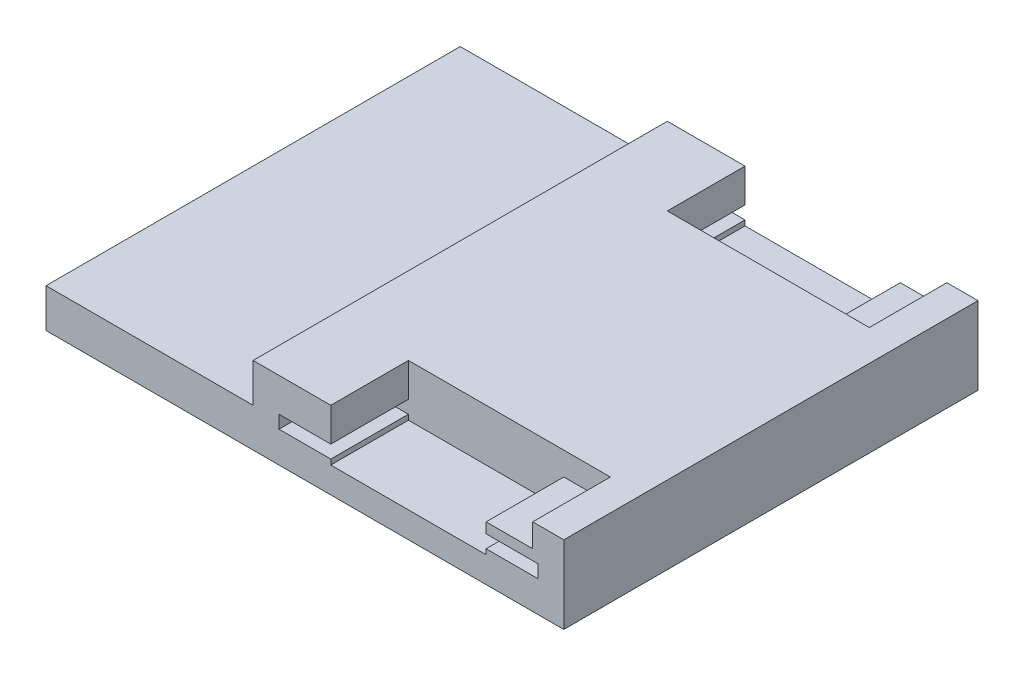
from build123d import *

# Parameters (mm, degrees)
SKETCH1_W               = 320
SKETCH1_H               = 160
BOSS_EXTRUDE1_DEPTH     = 20
SKETCH2_W               = 60
SKETCH2_H               = 30
CUT_EXTRUDE1_DEPTH      = 28
SKETCH3_W               = 20
SKETCH3_H               = 5
CUT_EXTRUDE3_DEPTH      = 30
MIRROR3_COPY_1_SKETCH_W = 60
MIRROR3_COPY_1_SKETCH_H = 30
MIRROR3_COPY_1_DEPTH    = 28
MIRROR3_COPY_2_SKETCH_W = 20
MIRROR3_COPY_2_SKETCH_H = 5
MIRROR3_COPY_2_DEPTH    = 30
SKETCH8_W               = 18
SKETCH8_H               = 9
CUT_EXTRUDE6_DEPTH      = 30
SKETCH9_W               = 18
SKETCH9_H               = 9
CUT_EXTRUDE7_DEPTH      = 30
SKETCH10_W              = 320
SKETCH10_H              = 160
BOSS_EXTRUDE2_DEPTH     = 10
CUT_EXTRUDE8_DEPTH      = 236


with BuildPart() as part:
    # Sketch1 → Boss-Extrude1 (new body)
    with BuildSketch(Plane(origin=(0, 0, 0), x_dir=(1, 0, 0), z_dir=(0, 1, 0))):
        Rectangle(SKETCH1_W, SKETCH1_H)
    extrude(amount=BOSS_EXTRUDE1_DEPTH)

    # Sketch2 → Cut-Extrude1 (cut)
    with BuildSketch(Plane(origin=(0, 20, 0), x_dir=(1, 0, 0), z_dir=(0, 1, 0))):
        with Locations((-100, -65)):
            Rectangle(SKETCH2_W, SKETCH2_H)
    cut_extrude1 = extrude(amount=-CUT_EXTRUDE1_DEPTH, mode=Mode.SUBTRACT)

    # Sketch3 → Cut-Extrude3 (cut)
    with BuildSketch(Plane.XY.offset(80)):
        with Locations((-140, 4.5)):
            Rectangle(SKETCH3_W, SKETCH3_H)
        with Locations((-60, 4.5)):
            Rectangle(SKETCH3_W, SKETCH3_H)
    cut_extrude3 = extrude(amount=-CUT_EXTRUDE3_DEPTH, mode=Mode.SUBTRACT)

    # Mirror2: Cut-Extrude1, Cut-Extrude3 across plane
    add(cut_extrude1.mirror(Plane(origin=(0, 0, 0), x_dir=(0, 0, 1), z_dir=(1, 0, 0))), mode=Mode.SUBTRACT)
    add(cut_extrude3.mirror(Plane(origin=(0, 0, 0), x_dir=(0, 0, 1), z_dir=(1, 0, 0))), mode=Mode.SUBTRACT)

    # Mirror3: Cut-Extrude1, Cut-Extrude3 across plane
    add(cut_extrude1.mirror(Plane.XY), mode=Mode.SUBTRACT)
    add(cut_extrude3.mirror(Plane.XY), mode=Mode.SUBTRACT)

    # Mirror3 copy 1 sketch → Mirror3 copy 1 (cut)
    with BuildSketch(Plane(origin=(0, 20, 0), x_dir=(-1, 0, 0), z_dir=(0, 1, 0))):
        with Locations((-100, -65)):
            Rectangle(MIRROR3_COPY_1_SKETCH_W, MIRROR3_COPY_1_SKETCH_H)
    extrude(amount=-MIRROR3_COPY_1_DEPTH, mode=Mode.SUBTRACT)

    # Mirror3 copy 2 sketch → Mirror3 copy 2 (cut)
    with BuildSketch(Plane(origin=(0, 0, -80), x_dir=(-1, 0, 0), z_dir=(0, 0, -1))):
        with Locations((-140, 4.5)):
            Rectangle(MIRROR3_COPY_2_SKETCH_W, MIRROR3_COPY_2_SKETCH_H)
        with Locations((-60, 4.5)):
            Rectangle(MIRROR3_COPY_2_SKETCH_W, MIRROR3_COPY_2_SKETCH_H)
    extrude(amount=-MIRROR3_COPY_2_DEPTH, mode=Mode.SUBTRACT)

    # Sketch8 → Cut-Extrude6 (cut)
    with BuildSketch(Plane(origin=(0, 0, -80), x_dir=(-1, 0, 0), z_dir=(0, 0, -1))):
        with Locations((-139, 15.5)):
            Rectangle(SKETCH8_W, SKETCH8_H)
    cut_extrude6 = extrude(amount=-CUT_EXTRUDE6_DEPTH, mode=Mode.SUBTRACT)

    # Sketch9 → Cut-Extrude7 (cut)
    with BuildSketch(Plane(origin=(0, 0, -80), x_dir=(-1, 0, 0), z_dir=(0, 0, -1))):
        with Locations((61, 15.5)):
            Rectangle(SKETCH9_W, SKETCH9_H)
    cut_extrude7 = extrude(amount=-CUT_EXTRUDE7_DEPTH, mode=Mode.SUBTRACT)

    # Sketch10 → Boss-Extrude2 (add)
    with BuildSketch(Plane.XZ):
        Rectangle(SKETCH10_W, SKETCH10_H)
    extrude(amount=BOSS_EXTRUDE2_DEPTH)

    # Mirror4: Cut-Extrude6, Cut-Extrude7 across plane
    add(cut_extrude6.mirror(Plane.XY), mode=Mode.SUBTRACT)
    add(cut_extrude7.mirror(Plane.XY), mode=Mode.SUBTRACT)

    # Sketch12 → Cut-Extrude8 (cut)
    with BuildSketch(Plane(origin=(0, 0, -80), x_dir=(-1, 0, 0), z_dir=(0, 0, -1))):
        Polygon((-40, 20), (-40, 5), (40, 5), (40, -10), (160, -10), (160, 20), align=None)
    extrude(amount=-CUT_EXTRUDE8_DEPTH, mode=Mode.SUBTRACT)


solid = part.part
